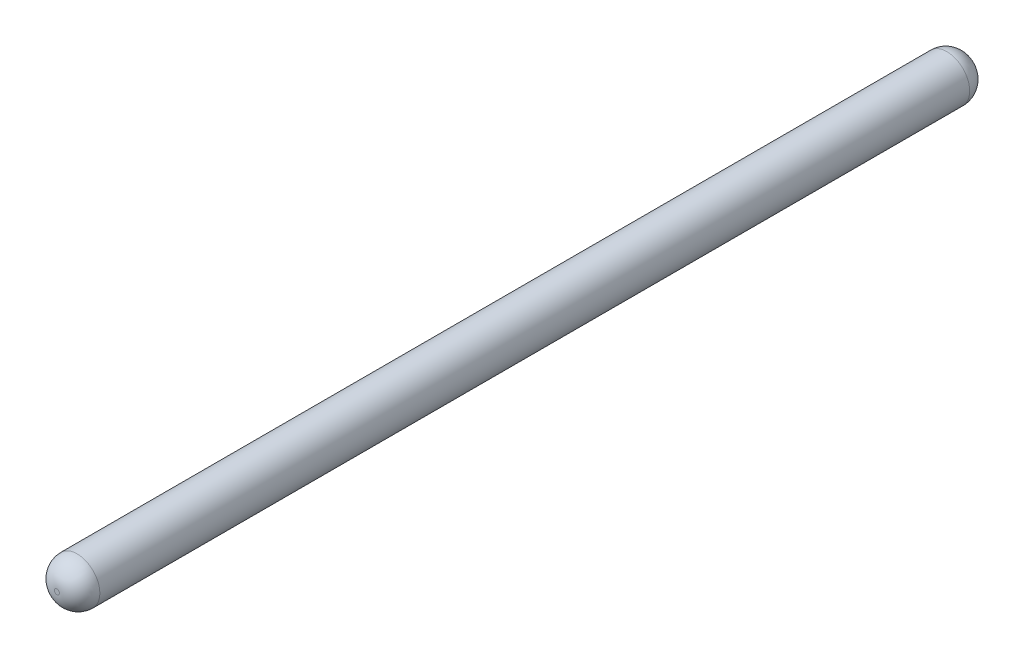
from build123d import *

# Parameters (mm, degrees)
SKETCH1_R           = 0.9
BOSS_EXTRUDE1_DEPTH = 36
FILLET1_R           = 0.8


with BuildPart() as part:
    # Sketch1 → Boss-Extrude1 (new body)
    with BuildSketch(Plane.XY):
        Circle(SKETCH1_R)
    extrude(amount=BOSS_EXTRUDE1_DEPTH)

    # Fillet1
    fillet1_edges = [part.edges().sort_by_distance(p)[0] for p in [
        (-0.9, 0, 0),
        (-0.9, 0, 36),
    ]]
    fillet(fillet1_edges, radius=FILLET1_R)


solid = part.part
